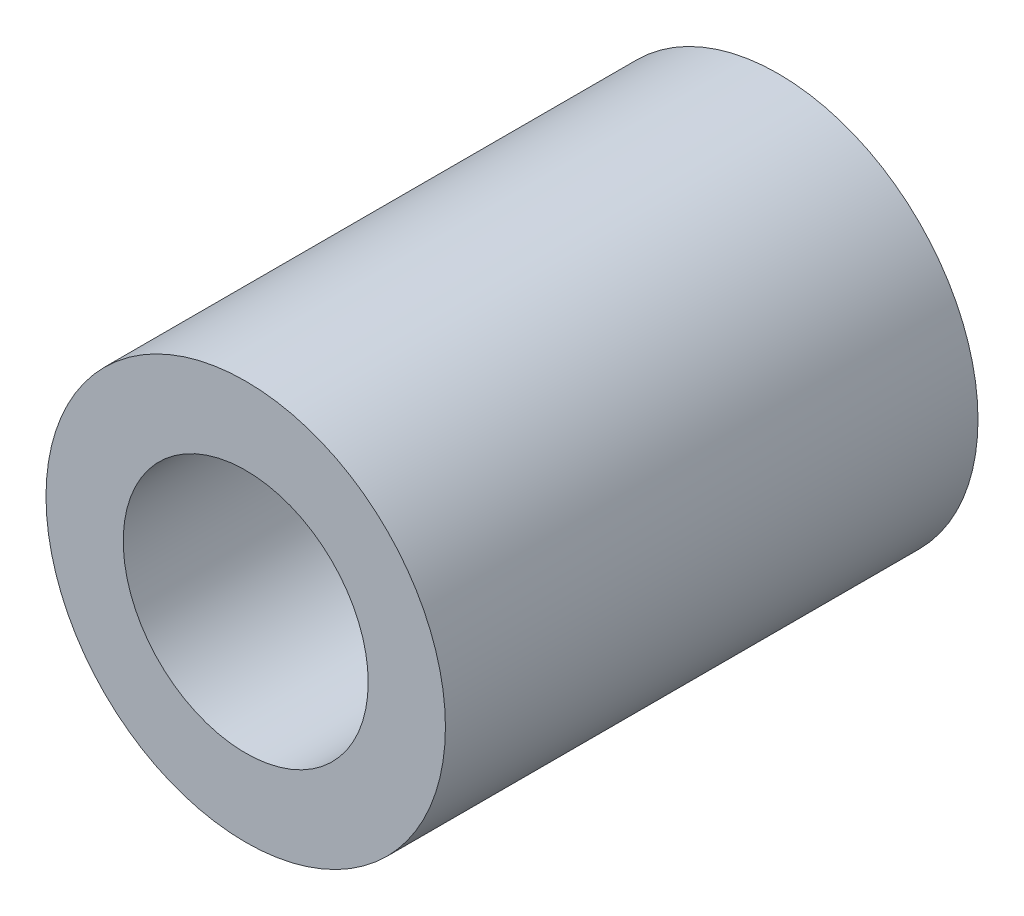
from build123d import *

# Parameters (mm, degrees)
EXTRUDE1_DEPTH      = 3.175
EXTRUDE1_DEPTH_BACK = 3.175
SKETCH1_R           = 2.38125
SKETCH1_R_2         = 1.4605


with BuildPart() as part:
    # Sketch1 → Extrude1 (new, two sides: drawn at the far end of the back side and taken through both)
    with BuildSketch(Plane.XY.offset(-EXTRUDE1_DEPTH_BACK)):
        Circle(SKETCH1_R)
        Circle(SKETCH1_R_2, mode=Mode.SUBTRACT)
    extrude(amount=EXTRUDE1_DEPTH + EXTRUDE1_DEPTH_BACK)


solid = part.part
